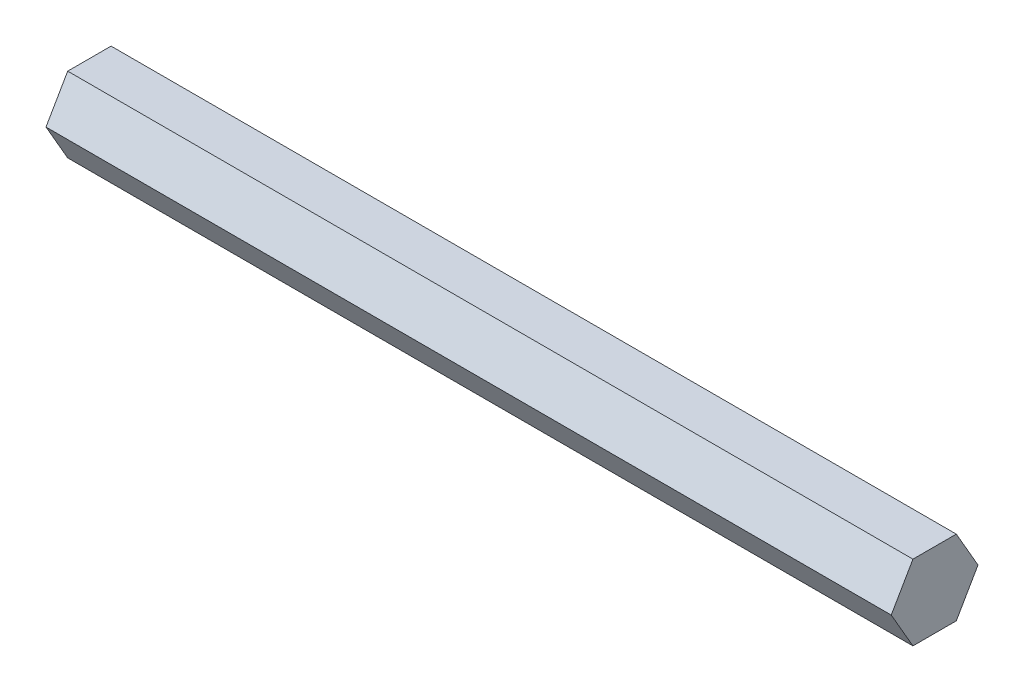
from build123d import *

# Parameters (mm, degrees)
BOSS_EXTRUDE1_DEPTH = 142.875


with BuildPart() as part:
    # Sketch2 → Boss-Extrude1 (new body)
    with BuildSketch(Plane(origin=(0, 0, 0), x_dir=(0, 0, -1), z_dir=(1, 0, 0))):
        Polygon((7.332348419, 0), (3.666174209, 6.35), (-3.666174209, 6.35), (-7.332348419, 0), (-3.666174209, -6.35), (3.666174209, -6.35), align=None)
    extrude(amount=BOSS_EXTRUDE1_DEPTH)


solid = part.part
